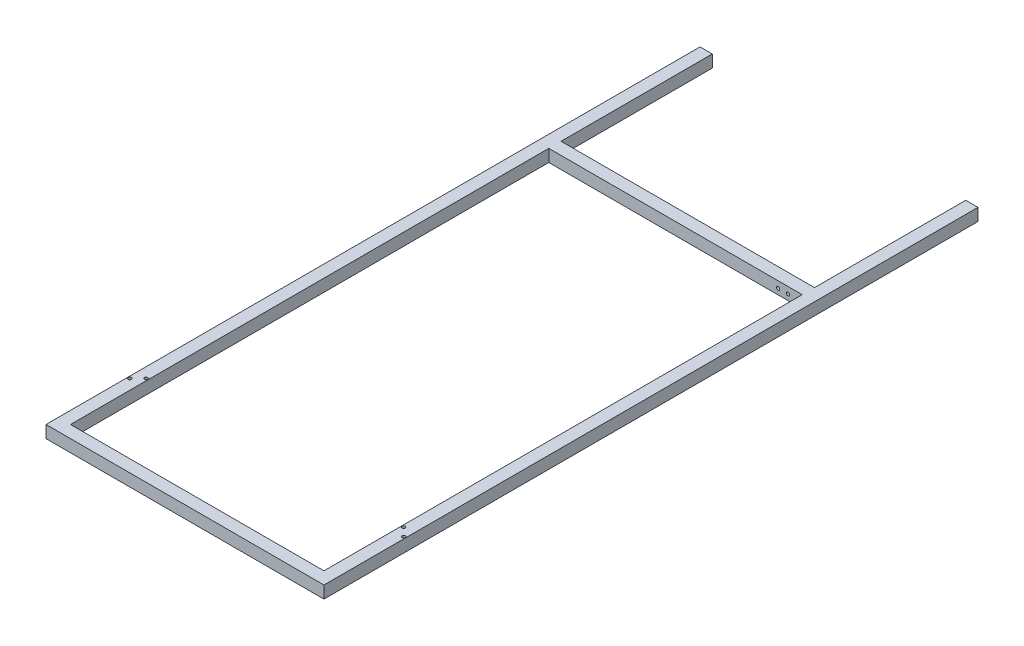
from build123d import *

# Parameters (mm, degrees)
SKETCH_2_W          = 340
SKETCH_2_H          = 800
EXTRUDE_1_DEPTH     = 15
SKETCH_3_W          = 310
SKETCH_3_H          = 785
CUT_EXTRUDE_1_DEPTH = 15
SKETCH_8_W          = 310
SKETCH_8_H          = 15
EXTRUDE_3_DEPTH     = 15
CUT_EXTRUDE_5_REACH = 640.949
SKETCH_10_R         = 2
SKETCH_11_R         = 2
CUT_EXTRUDE_6_DEPTH = 819.553864039


with BuildPart() as part:
    # 草图2 → 凸台-拉伸1 (new body)
    with BuildSketch(Plane(origin=(0, 0, 0), x_dir=(1, 0, 0), z_dir=(0, 1, 0))):
        with Locations((2.642487047, -400)):
            Rectangle(SKETCH_2_W, SKETCH_2_H)
    extrude(amount=EXTRUDE_1_DEPTH)

    # 草图3 → 切除-拉伸1 (cut)
    with BuildSketch(Plane(origin=(0, 15, 0), x_dir=(1, 0, 0), z_dir=(0, 1, 0))):
        with Locations((2.642487047, -392.5)):
            Rectangle(SKETCH_3_W, SKETCH_3_H)
    extrude(amount=-CUT_EXTRUDE_1_DEPTH, mode=Mode.SUBTRACT)

    # 草图8 → 凸台-拉伸3 (add)
    with BuildSketch(Plane(origin=(0, 15, 0), x_dir=(1, 0, 0), z_dir=(0, 1, 0))):
        with Locations((2.642487047, -192.5)):
            Rectangle(SKETCH_8_W, SKETCH_8_H)
    extrude(amount=-EXTRUDE_3_DEPTH)

    # 草图10 → 切除-拉伸5 (cut, up to next)
    with BuildSketch(Plane(origin=(0, 0, 185), x_dir=(-1, 0, 0), z_dir=(0, 0, -1)), mode=Mode.PRIVATE) as cut_extrude_5_sk1:
        with Locations((-152.142487047, 7)):
            Circle(SKETCH_10_R)
    cut_extrude_5_tool1 = extrude(cut_extrude_5_sk1.sketch, amount=-CUT_EXTRUDE_5_REACH, mode=Mode.PRIVATE) & part.part
    # 草图10 → 切除-拉伸5 (cut, up to next)
    with BuildSketch(Plane(origin=(0, 0, 185), x_dir=(-1, 0, 0), z_dir=(0, 0, -1)), mode=Mode.PRIVATE) as cut_extrude_5_sk2:
        with Locations((-140.142487047, 7)):
            Circle(SKETCH_10_R)
    cut_extrude_5_tool2 = extrude(cut_extrude_5_sk2.sketch, amount=-CUT_EXTRUDE_5_REACH, mode=Mode.PRIVATE) & part.part
    # 草图10 → 切除-拉伸5 (cut, up to next)
    with BuildSketch(Plane(origin=(0, 0, 185), x_dir=(-1, 0, 0), z_dir=(0, 0, -1)), mode=Mode.PRIVATE) as cut_extrude_5_sk3:
        with Locations((-128.142487047, 7)):
            Circle(SKETCH_10_R)
    cut_extrude_5_tool3 = extrude(cut_extrude_5_sk3.sketch, amount=-CUT_EXTRUDE_5_REACH, mode=Mode.PRIVATE) & part.part
    add(cut_extrude_5_tool1.solids().sort_by_distance((152.142487, 7, 185))[0], mode=Mode.SUBTRACT)
    add(cut_extrude_5_tool2.solids().sort_by_distance((140.142487, 7, 185))[0], mode=Mode.SUBTRACT)
    add(cut_extrude_5_tool3.solids().sort_by_distance((128.142487, 7, 185))[0], mode=Mode.SUBTRACT)

    # 草图11 → 切除-拉伸6 (cut, through all)
    with BuildSketch(Plane(origin=(0, 15, 0), x_dir=(1, 0, 0), z_dir=(0, 1, 0))):
        with Locations(Location((160.142487047, -690, 0), (0, 0, 270))):
            Circle(SKETCH_11_R)
        with Locations(Location((170.142487047, -700, 0), (0, 0, 270))):
            Circle(SKETCH_11_R)
        with Locations(Location((-154.857512953, -690, 0), (0, 0, 270))):
            Circle(SKETCH_11_R)
        with Locations(Location((-164.857512953, -700, 0), (0, 0, 270))):
            Circle(SKETCH_11_R)
    extrude(amount=-CUT_EXTRUDE_6_DEPTH, mode=Mode.SUBTRACT)


solid = part.part
